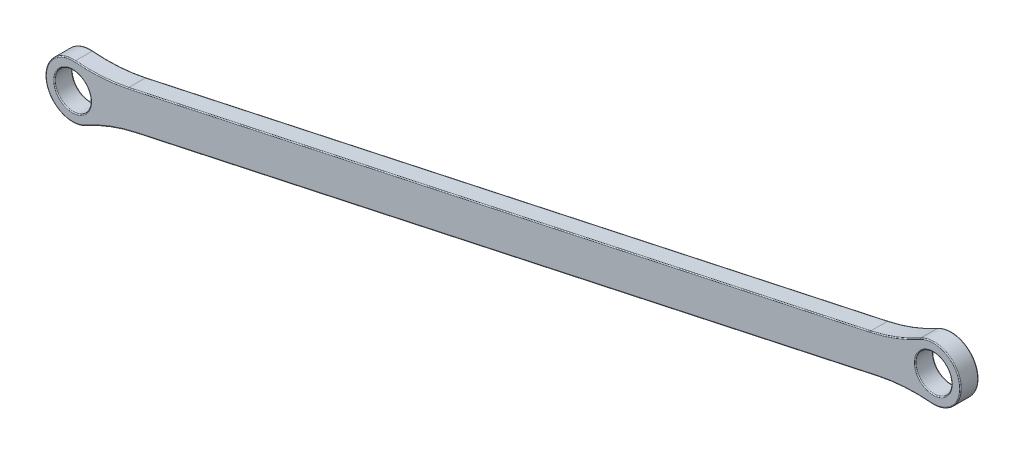
from build123d import *

# Parameters (mm, degrees)
BOSS_EXTRUDE1_DEPTH = 3
FILLET1_R           = 30
FILLET2_R           = 0.15


with BuildPart() as part:
    # Sketch1 → Boss-Extrude1 (new body)
    with BuildSketch(Plane.XY):
        with BuildLine():
            ThreePointArc((-210.420518845, 195.460135896), (-213.986124867, 197.75936483), (-211.686895932, 201.324970853))
            Line((-211.686895932, 201.324970853), (-208.408353522, 202.032897166))
            ThreePointArc((-208.408353522, 202.032897166), (-215.452333606, 197.442770559), (-207.141976435, 196.168062209))
            Line((-207.141976435, 196.168062209), (-210.420518845, 195.460135896))
        make_face()
        with BuildLine():
            Line((-72.254454388, 231.432220327), (-208.408353522, 202.032897166))
            ThreePointArc((-208.408353522, 202.032897166), (-207.04408818, 200.435334273), (-206.553707388, 198.392553374))
            ThreePointArc((-206.553707388, 198.392553374), (-206.703259751, 197.242072886), (-207.141976435, 196.168062209))
            Line((-207.141976435, 196.168062209), (-70.988077301, 225.56738537))
            ThreePointArc((-70.988077301, 225.56738537), (-72.741349652, 228.257946346), (-72.254454388, 231.432220327))
        make_face()
        with BuildLine():
            Line((-208.408353522, 202.032897166), (-211.686895932, 201.324970853))
            ThreePointArc((-211.686895932, 201.324970853), (-208.12128991, 199.025741918), (-210.420518845, 195.460135896))
            Line((-210.420518845, 195.460135896), (-207.141976435, 196.168062209))
            ThreePointArc((-207.141976435, 196.168062209), (-206.703259751, 197.242072886), (-206.553707388, 198.392553374))
            ThreePointArc((-206.553707388, 198.392553374), (-207.04408818, 200.435334273), (-208.408353522, 202.032897166))
        make_face()
        with BuildLine():
            ThreePointArc((-63.842723434, 229.207729162), (-67.192242946, 233.558176799), (-72.254454388, 231.432220327))
            Line((-72.254454388, 231.432220327), (-68.975911978, 232.14014664))
            ThreePointArc((-68.975911978, 232.14014664), (-65.410305956, 229.840917705), (-67.709534891, 226.275311683))
            Line((-67.709534891, 226.275311683), (-70.988077301, 225.56738537))
            ThreePointArc((-70.988077301, 225.56738537), (-66.299942535, 225.198109953), (-63.842723434, 229.207729162))
        make_face()
        with BuildLine():
            Line((-68.975911978, 232.14014664), (-72.254454388, 231.432220327))
            ThreePointArc((-72.254454388, 231.432220327), (-72.741349652, 228.257946346), (-70.988077301, 225.56738537))
            Line((-70.988077301, 225.56738537), (-67.709534891, 226.275311683))
            ThreePointArc((-67.709534891, 226.275311683), (-71.275140913, 228.574540618), (-68.975911978, 232.14014664))
        make_face()
    extrude(amount=-BOSS_EXTRUDE1_DEPTH)

    # Fillet1
    fillet1_edges = [part.edges().sort_by_distance(p)[0] for p in [
        (-208.408353522, 202.032897166, -1.5),
        (-72.254454388, 231.432220327, -1.5),
        (-70.988077301, 225.56738537, -1.5),
        (-207.141976435, 196.168062209, -1.5),
    ]]
    fillet(fillet1_edges, radius=FILLET1_R)

    # Fillet2
    fillet2_edges = [part.edges().sort_by_distance(p)[0] for p in [
        (-68.975911978, 232.14014664, 0),
        (-215.452333606, 197.442770559, 0),
        (-215.452333606, 197.442770559, -3),
        (-139.065026868, 210.867723789, 0),
        (-139.065026868, 210.867723789, -3),
        (-63.944097216, 230.157511977, 0),
        (-63.944097216, 230.157511977, -3),
        (-211.686895932, 201.324970853, -3),
        (-140.331403955, 216.732558746, 0),
        (-140.331403955, 216.732558746, -3),
        (-204.839302296, 196.329836852, 0),
        (-204.839302296, 196.329836852, -3),
        (-73.152345417, 224.764625911, 0),
        (-73.152345417, 224.764625911, -3),
        (-206.244085406, 202.835656624, 0),
        (-206.244085406, 202.835656624, -3),
        (-74.557128527, 231.270445683, 0),
        (-74.557128527, 231.270445683, -3),
        (-68.975911978, 232.14014664, -3),
        (-211.686895932, 201.324970853, 0),
    ]]
    fillet(fillet2_edges, radius=FILLET2_R)


solid = part.part
